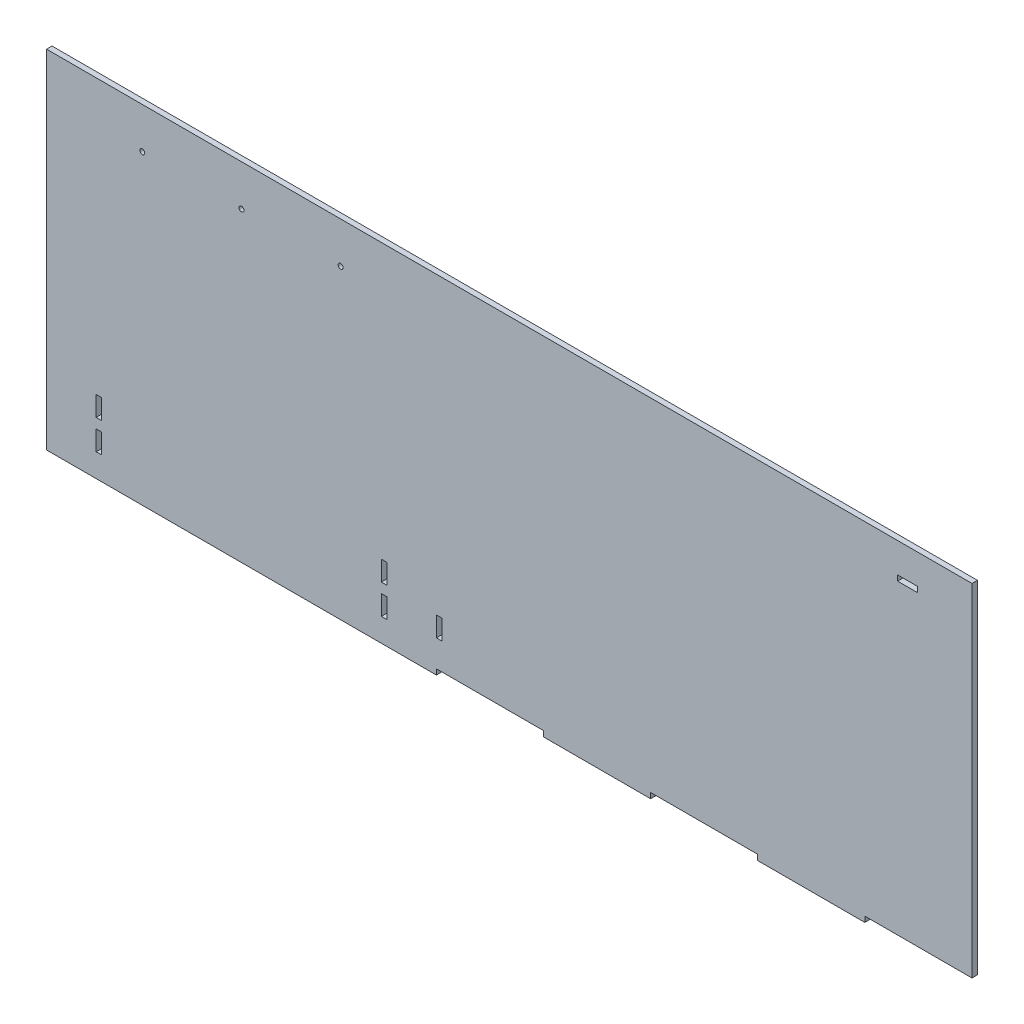
from build123d import *

# Parameters (mm, degrees)
CROQUIS1_R              = 2.5
CROQUIS1_W              = 5.5
CROQUIS1_H              = 20
SALIENTE_EXTRUIR2_DEPTH = 5.5


with BuildPart() as part:
    # Croquis1 → Saliente-Extruir2 (new body)
    with BuildSketch(Plane.XY):
        Polygon((-291.621999317, -23.071413697), (101.378000683, -23.071413697), (101.378000683, -17.571413697), (209.378000683, -17.571413697), (209.378000683, -23.071413697), (317.378000683, -23.071413697), (317.378000683, -17.571413697), (425.378000683, -17.571413697), (425.378000683, -23.071413697), (533.378000683, -23.071413697), (533.378000683, -17.571413697), (641.378000683, -17.571413697), (641.378000683, 326.928586303), (-291.621999317, 326.928586303), align=None)
        with Locations((-195.121999317, 285.627487196)):
            Circle(CROQUIS1_R, mode=Mode.SUBTRACT)
        with Locations((-95.121999317, 285.627487196)):
            Circle(CROQUIS1_R, mode=Mode.SUBTRACT)
        with Locations((4.878000683, 285.627487196)):
            Circle(CROQUIS1_R, mode=Mode.SUBTRACT)
        with Locations((-238.871999317, 10.407487196)):
            Rectangle(CROQUIS1_W, CROQUIS1_H, mode=Mode.SUBTRACT)
        with Locations((48.628000683, 10.407487196)):
            Rectangle(CROQUIS1_W, CROQUIS1_H, mode=Mode.SUBTRACT)
        with Locations((-238.871999317, 40.407487196)):
            Rectangle(CROQUIS1_W, CROQUIS1_H, mode=Mode.SUBTRACT)
        with Locations((48.628000683, 40.407487196)):
            Rectangle(CROQUIS1_W, CROQUIS1_H, mode=Mode.SUBTRACT)
        Polygon((576.378000683, 296.928586303), (566.378000683, 296.928586303), (566.378000683, 291.428586303), (586.378000683, 291.428586303), (586.378000683, 296.928586303), align=None, mode=Mode.SUBTRACT)
        with Locations((104.128000683, 19.428586303)):
            Rectangle(CROQUIS1_W, CROQUIS1_H, mode=Mode.SUBTRACT)
    extrude(amount=SALIENTE_EXTRUIR2_DEPTH)


solid = part.part
